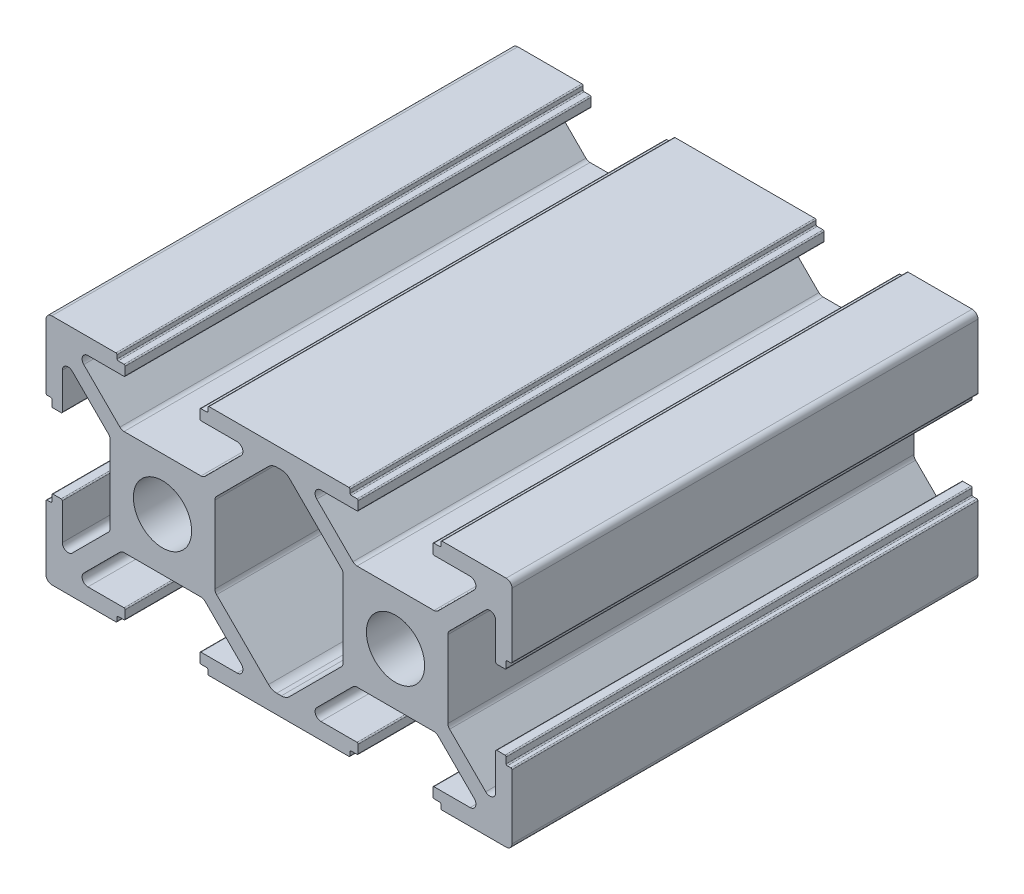
from build123d import *

# Parameters (mm, degrees)
IZIM1_R                     = 2.5
Y_KSEKLIK_EKSTR_ZYON1_DEPTH = 40


with BuildPart() as part:
    # Çizim1 → Yükseklik-Ekstrüzyon1 (new body)
    with BuildSketch(Plane.XY):
        with BuildLine():
            ThreePointArc((4.5, 3.302943725), (4.538060234, 3.494285441), (4.646446609, 3.656497116))
            Line((4.646446609, 3.656497116), (7.746446609, 6.756497116))
            ThreePointArc((7.746446609, 6.756497116), (8.291341716, 6.864883491), (8.6, 6.402943725))
            Line((8.6, 6.402943725), (8.6, 3.3))
            ThreePointArc((8.6, 3.3), (8.629289322, 3.229289322), (8.7, 3.2))
            Line((8.7, 3.2), (9.4, 3.2))
            ThreePointArc((9.4, 3.2), (9.470710678, 3.229289322), (9.5, 3.3))
            Line((9.5, 3.3), (9.5, 3.8))
            ThreePointArc((9.5, 3.8), (9.529289322, 3.870710678), (9.6, 3.9))
            Line((9.6, 3.9), (9.9, 3.9))
            ThreePointArc((9.9, 3.9), (9.970710678, 3.929289322), (10, 4))
            Line((10, 4), (10, 9.5))
            ThreePointArc((10, 9.5), (9.853553391, 9.853553391), (9.5, 10))
            Line((9.5, 10), (4, 10))
            ThreePointArc((4, 10), (3.929289322, 9.970710678), (3.9, 9.9))
            Line((3.9, 9.9), (3.9, 9.6))
            ThreePointArc((3.9, 9.6), (3.870710678, 9.529289322), (3.8, 9.5))
            Line((3.8, 9.5), (3.3, 9.5))
            ThreePointArc((3.3, 9.5), (3.229289322, 9.470710678), (3.2, 9.4))
            Line((3.2, 9.4), (3.2, 8.7))
            ThreePointArc((3.2, 8.7), (3.229289322, 8.629289322), (3.3, 8.6))
            Line((3.3, 8.6), (6.402943725, 8.6))
            ThreePointArc((6.402943725, 8.6), (6.864883491, 8.291341716), (6.756497116, 7.746446609))
            Line((6.756497116, 7.746446609), (3.656497116, 4.646446609))
            ThreePointArc((3.656497116, 4.646446609), (3.494285441, 4.538060234), (3.302943725, 4.5))
            Line((3.302943725, 4.5), (-3.302943725, 4.5))
            ThreePointArc((-3.302943725, 4.5), (-3.494285441, 4.538060234), (-3.656497116, 4.646446609))
            Line((-3.656497116, 4.646446609), (-6.756497116, 7.746446609))
            ThreePointArc((-6.756497116, 7.746446609), (-6.864883491, 8.291341716), (-6.402943725, 8.6))
            Line((-6.402943725, 8.6), (-3.3, 8.6))
            ThreePointArc((-3.3, 8.6), (-3.229289322, 8.629289322), (-3.2, 8.7))
            Line((-3.2, 8.7), (-3.2, 9.4))
            ThreePointArc((-3.2, 9.4), (-3.229289322, 9.470710678), (-3.3, 9.5))
            Line((-3.3, 9.5), (-3.8, 9.5))
            ThreePointArc((-3.8, 9.5), (-3.870710678, 9.529289322), (-3.9, 9.6))
            Line((-3.9, 9.6), (-3.9, 9.9))
            ThreePointArc((-3.9, 9.9), (-3.929289322, 9.970710678), (-4, 10))
            Line((-4, 10), (-10, 10))
            Line((-10, 10), (-10, 8.4))
            Line((-10, 8.4), (-9.804163056, 8.4))
            ThreePointArc((-9.804163056, 8.4), (-9.421479624, 8.323879533), (-9.097056275, 8.107106781))
            Line((-9.097056275, 8.107106781), (-4.646446609, 3.656497116))
            ThreePointArc((-4.646446609, 3.656497116), (-4.538060234, 3.494285441), (-4.5, 3.302943725))
            Line((-4.5, 3.302943725), (-4.5, -3.302943725))
            ThreePointArc((-4.5, -3.302943725), (-4.538060234, -3.494285441), (-4.646446609, -3.656497116))
            Line((-4.646446609, -3.656497116), (-9.097056275, -8.107106781))
            ThreePointArc((-9.097056275, -8.107106781), (-9.421479624, -8.323879533), (-9.804163056, -8.4))
            Line((-9.804163056, -8.4), (-10, -8.4))
            Line((-10, -8.4), (-10, -10))
            Line((-10, -10), (-4, -10))
            ThreePointArc((-4, -10), (-3.929289322, -9.970710678), (-3.9, -9.9))
            Line((-3.9, -9.9), (-3.9, -9.6))
            ThreePointArc((-3.9, -9.6), (-3.870710678, -9.529289322), (-3.8, -9.5))
            Line((-3.8, -9.5), (-3.3, -9.5))
            ThreePointArc((-3.3, -9.5), (-3.229289322, -9.470710678), (-3.2, -9.4))
            Line((-3.2, -9.4), (-3.2, -8.7))
            ThreePointArc((-3.2, -8.7), (-3.229289322, -8.629289322), (-3.3, -8.6))
            Line((-3.3, -8.6), (-6.402943725, -8.6))
            ThreePointArc((-6.402943725, -8.6), (-6.864883491, -8.291341716), (-6.756497116, -7.746446609))
            Line((-6.756497116, -7.746446609), (-3.656497116, -4.646446609))
            ThreePointArc((-3.656497116, -4.646446609), (-3.494285441, -4.538060234), (-3.302943725, -4.5))
            Line((-3.302943725, -4.5), (3.302943725, -4.5))
            ThreePointArc((3.302943725, -4.5), (3.494285441, -4.538060234), (3.656497116, -4.646446609))
            Line((3.656497116, -4.646446609), (6.756497116, -7.746446609))
            ThreePointArc((6.756497116, -7.746446609), (6.864883491, -8.291341716), (6.402943725, -8.6))
            Line((6.402943725, -8.6), (3.3, -8.6))
            ThreePointArc((3.3, -8.6), (3.229289322, -8.629289322), (3.2, -8.7))
            Line((3.2, -8.7), (3.2, -9.4))
            ThreePointArc((3.2, -9.4), (3.229289322, -9.470710678), (3.3, -9.5))
            Line((3.3, -9.5), (3.8, -9.5))
            ThreePointArc((3.8, -9.5), (3.870710678, -9.529289322), (3.9, -9.6))
            Line((3.9, -9.6), (3.9, -9.9))
            ThreePointArc((3.9, -9.9), (3.929289322, -9.970710678), (4, -10))
            Line((4, -10), (9.5, -10))
            ThreePointArc((9.5, -10), (9.853553391, -9.853553391), (10, -9.5))
            Line((10, -9.5), (10, -4))
            ThreePointArc((10, -4), (9.970710678, -3.929289322), (9.9, -3.9))
            Line((9.9, -3.9), (9.6, -3.9))
            ThreePointArc((9.6, -3.9), (9.529289322, -3.870710678), (9.5, -3.8))
            Line((9.5, -3.8), (9.5, -3.3))
            ThreePointArc((9.5, -3.3), (9.470710678, -3.229289322), (9.4, -3.2))
            Line((9.4, -3.2), (8.7, -3.2))
            ThreePointArc((8.7, -3.2), (8.629289322, -3.229289322), (8.6, -3.3))
            Line((8.6, -3.3), (8.6, -6.402943725))
            ThreePointArc((8.6, -6.402943725), (8.291341716, -6.864883491), (7.746446609, -6.756497116))
            Line((7.746446609, -6.756497116), (4.646446609, -3.656497116))
            ThreePointArc((4.646446609, -3.656497116), (4.538060234, -3.494285441), (4.5, -3.302943725))
            Line((4.5, -3.302943725), (4.5, 3.302943725))
        make_face()
        Circle(IZIM1_R, mode=Mode.SUBTRACT)
    extrude(amount=-Y_KSEKLIK_EKSTR_ZYON1_DEPTH)

    # Aynalama1: part across face


with BuildPart() as part_1:
    add(part.part)
    add(part.part.mirror(Plane(origin=(-10, 9.2, -20), x_dir=(0, 0, 1), z_dir=(-1, 0, 0))))


solid = part_1.part
